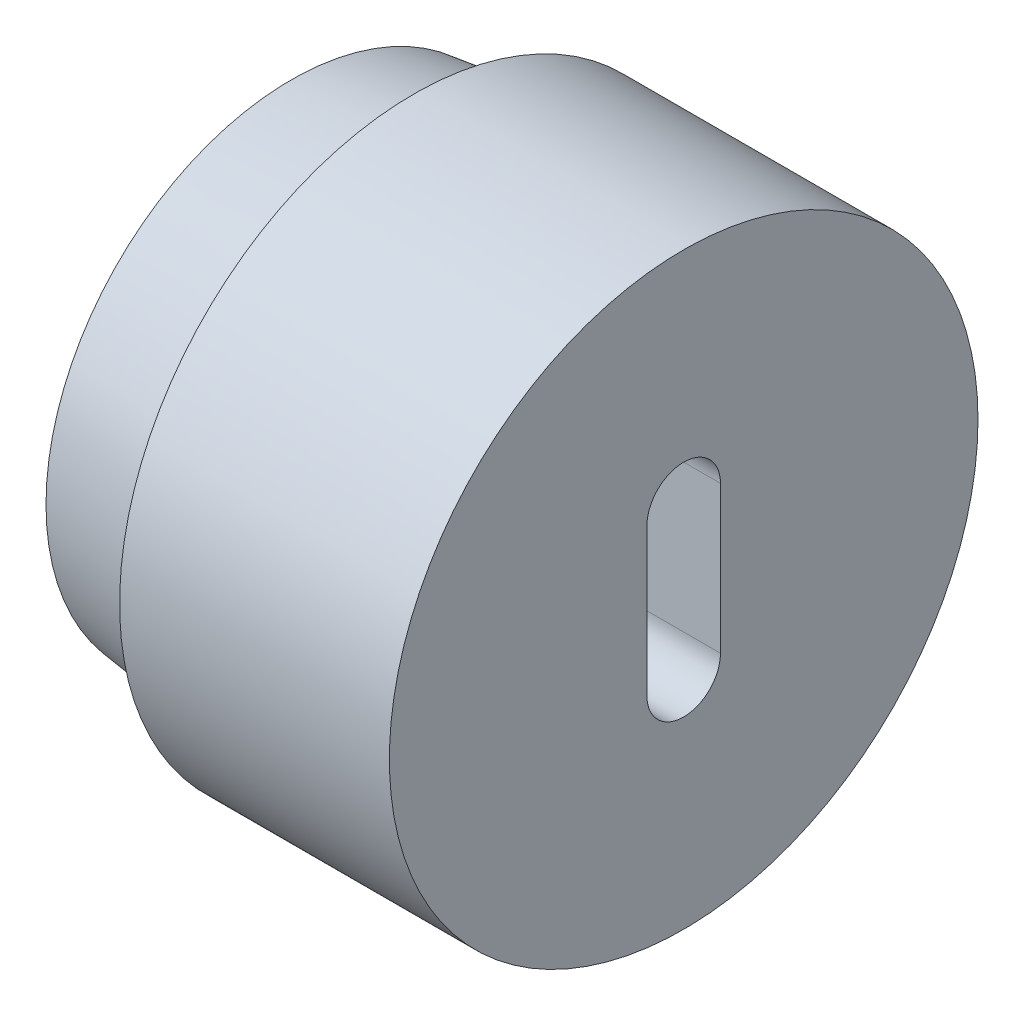
from build123d import *

# Parameters (mm, degrees)
ENL_V_MAT_EXTRU_1_DEPTH = 2


with BuildPart() as part:
    # Esquisse1 → Révolution1 (revolve)
    with BuildSketch(Plane.XY):
        with BuildLine():
            Line((0, 0), (0, 6))
            Line((0, 6), (-5.5, 6))
            Line((-5.5, 6), (-6, 5.25))
            Line((-6, 5.25), (-8, 5))
            Line((-8, 5), (-8, 3.624621125))
            ThreePointArc((-8, 3.624621125), (-7.83056435, 3.132291358), (-7.3940285, 2.848507125))
            Line((-7.3940285, 2.848507125), (-6.30298575, 2.575746437))
            ThreePointArc((-6.30298575, 2.575746437), (-6.084717825, 2.433854321), (-6, 2.187689437))
            Line((-6, 2.187689437), (-6, 0))
            Line((-6, 0), (0, 0))
        make_face()
    revolve(axis=Axis((3.088773822, 0, 0), (-1, 0, 0)))

    # Esquisse2 → Enlèv. mat.-Extru.1 (cut)
    with BuildSketch(Plane(origin=(0, 0, 0), x_dir=(0, 0, -1), z_dir=(1, 0, 0))):
        with BuildLine():
            Line((-0.75, -1.5), (-0.75, 1.5))
            ThreePointArc((-0.75, 1.5), (0, 2.25), (0.75, 1.5))
            Line((0.75, 1.5), (0.75, -1.5))
            ThreePointArc((0.75, -1.5), (0, -2.25), (-0.75, -1.5))
        make_face()
    extrude(amount=-ENL_V_MAT_EXTRU_1_DEPTH, mode=Mode.SUBTRACT)


solid = part.part
